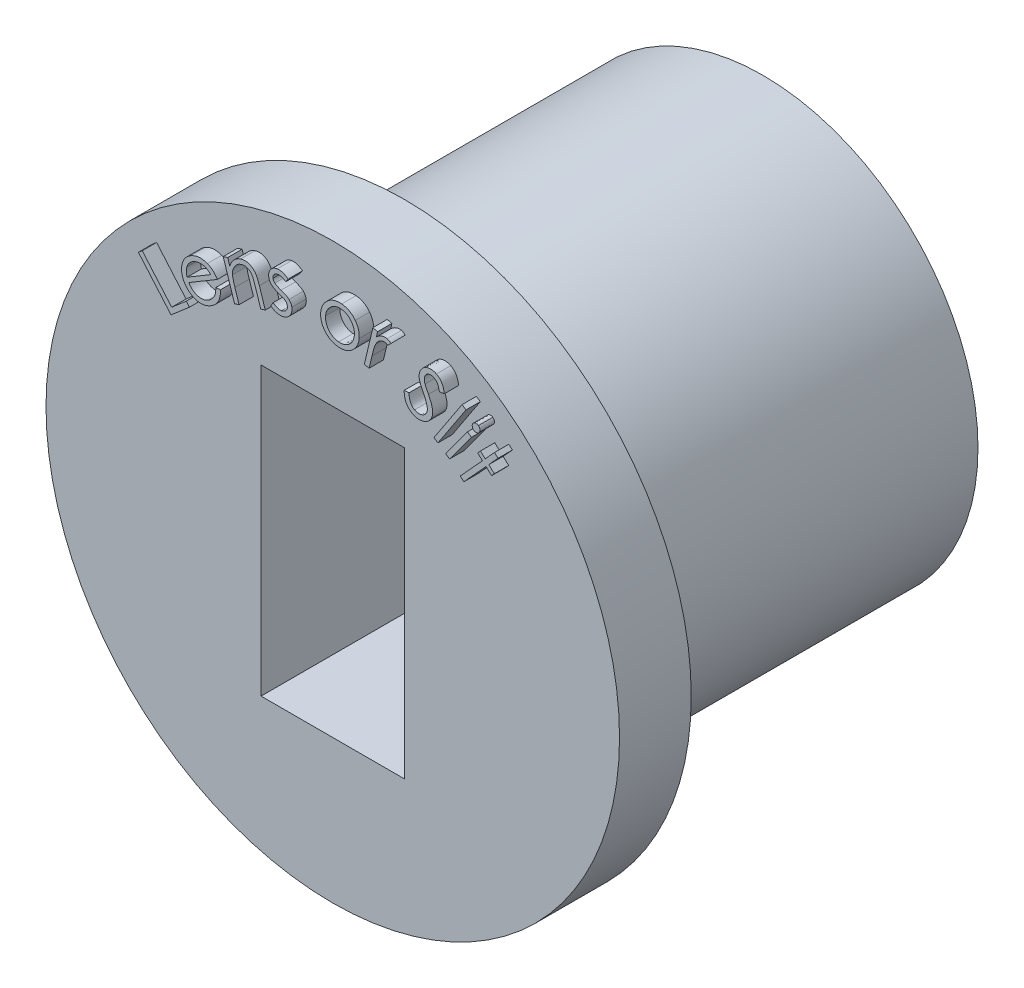
from build123d import *

# Parameters (mm, degrees)
SKETCH1_R           = 15
SKETCH1_W           = 10
SKETCH1_H           = 20
BOSS_EXTRUDE1_DEPTH = 25
SKETCH2_R           = 20
SKETCH2_W           = 10
SKETCH2_H           = 20
BOSS_EXTRUDE2_DEPTH = 5
BOSS_EXTRUDE3_DEPTH = 1


with BuildPart() as part:
    # Sketch1 → Boss-Extrude1 (new body)
    with BuildSketch(Plane.XY):
        Circle(SKETCH1_R)
        Rectangle(SKETCH1_W, SKETCH1_H, mode=Mode.SUBTRACT)
    extrude(amount=BOSS_EXTRUDE1_DEPTH)

    # Sketch2 → Boss-Extrude2 (add)
    with BuildSketch(Plane.XY.offset(25)):
        Circle(SKETCH2_R)
        Rectangle(SKETCH2_W, SKETCH2_H, mode=Mode.SUBTRACT)
    extrude(amount=BOSS_EXTRUDE2_DEPTH)

    # Sketch3 → Boss-Extrude3 (add)
    # profile 1 of 11: a face of its own
    with BuildSketch(Plane.XY.offset(30)):
        Polygon((12.280012906, 13.855492235), (12.527508899, 13.629731017), (11.880373483, 12.921598004), (12.269496079, 12.566129254), (12.077388707, 12.355792715), (11.688266111, 12.711261465), (10.139488066, 11.014546722), (9.891992073, 11.24030794), (11.440770117, 12.937022683), (11.106335021, 13.242711786), (11.298442393, 13.453048324), (11.632877489, 13.147359222), align=None)
    # profile 2 of 11: a face of its own
    with BuildSketch(Plane.XY.offset(30)):
        with BuildLine():
            add(Edge.make_bspline(
                [(11.158694311, 14.918955756), (11.173048853, 14.907377467), (11.201092682, 14.88475748), (11.233333186, 14.841105437), (11.255836986, 14.792111188), (11.268928006, 14.739056839), (11.272686342, 14.684853485), (11.265717383, 14.631542336), (11.24716263, 14.580941884), (11.227549596, 14.550767221), (11.217588541, 14.535442134)],
                knots=[0, 0, 0, 0, 1.023822878, 2.000196958, 2.99035988, 4.010202223, 5.027715397, 5.999827523, 6.984153789, 8, 8, 8, 8], degree=3))
            add(Edge.make_bspline(
                [(11.217588541, 14.535442134), (11.20625231, 14.521306848), (11.184113114, 14.493701213), (11.140951292, 14.462288631), (11.09269708, 14.43959769), (11.039803228, 14.426374808), (10.985339592, 14.423827271), (10.93179812, 14.430361515), (10.880976628, 14.449098018), (10.850802154, 14.468697233), (10.835477163, 14.478651269)],
                knots=[0, 0, 0, 0, 1.010024463, 1.972536316, 2.955356377, 3.979839316, 5.001229279, 5.990726125, 6.979531377, 8, 8, 8, 8], degree=3))
            add(Edge.make_bspline(
                [(10.835477163, 14.478651269), (10.821602513, 14.490023619), (10.794376563, 14.512339354), (10.763235652, 14.555134915), (10.740098072, 14.602998314), (10.727425267, 14.655766335), (10.7235033, 14.710206605), (10.730783089, 14.763231304), (10.747377217, 14.814177708), (10.767176494, 14.843625924), (10.777284054, 14.858659282)],
                knots=[0, 0, 0, 0, 1.006926823, 1.975872422, 2.953366135, 3.984697055, 5.013672567, 6.009783536, 6.983991547, 8, 8, 8, 8], degree=3))
            add(Edge.make_bspline(
                [(10.777284054, 14.858659282), (10.788949457, 14.872676931), (10.811936859, 14.90029958), (10.854557521, 14.9333573), (10.903813098, 14.955006082), (10.956468699, 14.968316043), (11.010856731, 14.971646889), (11.064012712, 14.966068794), (11.114034101, 14.947642042), (11.143592709, 14.928655865), (11.158694311, 14.918955756)],
                knots=[0, 0, 0, 0, 1.021064848, 2.012071682, 2.991656686, 4.018510453, 5.043019038, 6.033158621, 6.995133462, 8, 8, 8, 8], degree=3))
        make_face()
    # profile 3 of 11: a face of its own
    with BuildSketch(Plane.XY.offset(30)):
        Polygon((10.397977163, 14.16244534), (10.666506811, 13.965430115), (9.14296915, 11.891511846), (8.874439503, 12.08852707), align=None)
    # profile 4 of 11: a face of its own
    with BuildSketch(Plane.XY.offset(30)):
        Polygon((10.017616344, 15.61553359), (10.29315721, 15.433943045), (8.332820671, 12.460485513), (8.057279806, 12.642076058), align=None)
    # profile 5 of 11: a face of its own
    with BuildSketch(Plane.XY.offset(30)):
        with BuildLine():
            Line((5.974661386, 14.451609991), (6.316808822, 14.477551498))
            add(Edge.make_bspline(
                [(6.316808822, 14.477551498), (6.319328783, 14.425575727), (6.324140862, 14.326323586), (6.346545225, 14.185188581), (6.377061583, 14.058159144), (6.419580549, 13.945393962), (6.474118651, 13.847651546), (6.537911775, 13.763311791), (6.614137236, 13.694209408), (6.672530048, 13.660680916), (6.701724688, 13.643917683)],
                knots=[0, 0, 0, 0, 1.294332013, 2.471636748, 3.550932804, 4.54157675, 5.460838043, 6.327658205, 7.163879688, 8, 8, 8, 8], degree=3))
            add(Edge.make_bspline(
                [(6.701724688, 13.643917683), (6.727862714, 13.63178557), (6.779449964, 13.607841055), (6.861345851, 13.583920057), (6.945224594, 13.570772307), (7.030178737, 13.567147205), (7.11388385, 13.573868674), (7.193570857, 13.591470689), (7.268356582, 13.618909376), (7.336966289, 13.657071381), (7.399205056, 13.703307632), (7.454369687, 13.756074285), (7.501495255, 13.815523438), (7.525894259, 13.859489963), (7.538162989, 13.881597972)],
                knots=[0, 0, 0, 0, 1.071300609, 2.114369768, 3.162539894, 4.22458465, 5.271960517, 6.278599416, 7.252851185, 8.226092924, 9.189843586, 10.131036101, 11.060215223, 12, 12, 12, 12], degree=3))
            add(Edge.make_bspline(
                [(7.538162989, 13.881597972), (7.549894226, 13.908145054), (7.573645265, 13.961892224), (7.591502122, 14.05016733), (7.59786236, 14.143752097), (7.590389914, 14.207190264), (7.586540393, 14.239871209)],
                knots=[0, 0, 0, 0, 0.946354176, 1.915986831, 2.926395213, 4, 4, 4, 4], degree=3))
            add(Edge.make_bspline(
                [(7.586540393, 14.239871209), (7.582422461, 14.26424329), (7.573769977, 14.315453221), (7.553373094, 14.394883051), (7.527685929, 14.480822159), (7.494698331, 14.572871585), (7.457306089, 14.671581513), (7.412511566, 14.77631339), (7.362287052, 14.887713564), (7.325232791, 14.963528176), (7.306091675, 15.002691722)],
                knots=[0, 0, 0, 0, 0.727086387, 1.527733436, 2.411096097, 3.365963597, 4.404357759, 5.516922391, 6.717316843, 8, 8, 8, 8], degree=3))
            add(Edge.make_bspline(
                [(7.306091675, 15.002691722), (7.287075844, 15.041679637), (7.250735919, 15.116186922), (7.200142103, 15.223309921), (7.156429597, 15.320694735), (7.120070887, 15.408825738), (7.088849195, 15.486831599), (7.064862206, 15.555562073), (7.047443849, 15.614504079), (7.040147212, 15.650943407), (7.036860906, 15.667355183)],
                knots=[0, 0, 0, 0, 1.448216104, 2.76759223, 3.955150454, 5.011501203, 5.950409205, 6.75977509, 7.441419598, 8, 8, 8, 8], degree=3))
            add(Edge.make_bspline(
                [(7.036860906, 15.667355183), (7.032966854, 15.692081372), (7.025245059, 15.741112704), (7.020597006, 15.814520611), (7.021153733, 15.88647439), (7.027459135, 15.956829331), (7.039449575, 16.025759746), (7.056857993, 16.093438471), (7.080899003, 16.159396492), (7.100593857, 16.201974757), (7.110478694, 16.223344767)],
                knots=[0, 0, 0, 0, 1.052088584, 2.086261862, 3.088710417, 4.075427982, 5.052901627, 6.027802968, 7.010155264, 8, 8, 8, 8], degree=3))
            add(Edge.make_bspline(
                [(7.110478694, 16.223344767), (7.12842154, 16.255595575), (7.163809154, 16.319201936), (7.229477941, 16.405646306), (7.306052667, 16.480263596), (7.391002869, 16.544345354), (7.483831851, 16.596433543), (7.582848745, 16.635315225), (7.687798218, 16.659185431), (7.796405728, 16.669287113), (7.906891678, 16.66680507), (8.01619596, 16.649746782), (8.123601195, 16.618923178), (8.191496727, 16.587668527), (8.22596347, 16.571802299)],
                knots=[0, 0, 0, 0, 1.018769018, 2.009257862, 2.986334619, 3.963880602, 4.940957359, 5.918162109, 6.89235458, 7.904246117, 8.924732369, 9.937447553, 10.952958141, 12, 12, 12, 12], degree=3))
            add(Edge.make_bspline(
                [(8.22596347, 16.571802299), (8.26134735, 16.552367752), (8.331391598, 16.513896047), (8.426358913, 16.440506356), (8.51003461, 16.354974572), (8.571346363, 16.27441543), (8.615202271, 16.202847267), (8.64567233, 16.142416502), (8.674791737, 16.076373738), (8.70014381, 16.003654276), (8.725049164, 15.925534061), (8.74620045, 15.840812764), (8.767031428, 15.75075453), (8.777820708, 15.688217119), (8.783355297, 15.656137235)],
                knots=[0, 0, 0, 0, 1.298236935, 2.569928111, 3.846883915, 5.141080741, 5.819851908, 6.546713814, 7.31834626, 8.141833165, 9.024741758, 9.9572964, 10.95215212, 12, 12, 12, 12], degree=3))
            Line((8.783355297, 15.656137235), (8.434897765, 15.59163403))
            add(Edge.make_bspline(
                [(8.434897765, 15.59163403), (8.430179032, 15.617380062), (8.421054457, 15.667164957), (8.4048204, 15.738412184), (8.388050598, 15.80389987), (8.370516483, 15.863528928), (8.352608909, 15.91778518), (8.332844847, 15.966108956), (8.312894871, 16.008947331), (8.284745733, 16.057698244), (8.245002449, 16.1111413), (8.190831909, 16.168051662), (8.12830948, 16.216215549), (8.082348912, 16.241900623), (8.059096483, 16.254895248)],
                knots=[0, 0, 0, 0, 1.185424393, 2.292245544, 3.308941189, 4.246811103, 5.10709974, 5.895339888, 6.610305932, 7.245783415, 8.441981835, 9.617343988, 10.794563669, 12, 12, 12, 12], degree=3))
            add(Edge.make_bspline(
                [(8.059096483, 16.254895248), (8.028685665, 16.268762928), (7.969754304, 16.295636302), (7.876299706, 16.314393336), (7.784348962, 16.315516955), (7.695752385, 16.297766279), (7.613496282, 16.264328417), (7.540903203, 16.215947919), (7.480606802, 16.152109526), (7.451406646, 16.101330255), (7.436500329, 16.075408068)],
                knots=[0, 0, 0, 0, 1.105526546, 2.142335817, 3.134576258, 4.137927418, 5.118226667, 6.062050744, 7.010700974, 8, 8, 8, 8], degree=3))
            add(Edge.make_bspline(
                [(7.436500329, 16.075408068), (7.428629193, 16.058505124), (7.412887541, 16.024700565), (7.396277182, 15.970953749), (7.384979455, 15.915286781), (7.379343725, 15.857040853), (7.379738752, 15.794630981), (7.390026363, 15.726948744), (7.405797699, 15.652521393), (7.421792003, 15.601563755), (7.430190233, 15.574807107)],
                knots=[0, 0, 0, 0, 0.867937434, 1.735806555, 2.613525405, 3.510685419, 4.458114981, 5.513026733, 6.694149273, 8, 8, 8, 8], degree=3))
            add(Edge.make_bspline(
                [(7.430190233, 15.574807107), (7.433592002, 15.5656494), (7.4418046, 15.543540742), (7.459352581, 15.506173258), (7.480388893, 15.457498891), (7.509434152, 15.39952163), (7.541483845, 15.329921357), (7.58133383, 15.251204025), (7.625419201, 15.16142161), (7.6572817, 15.09847602), (7.674180617, 15.065091562)],
                knots=[0, 0, 0, 0, 0.41462089, 1.000983375, 1.751573742, 2.665807653, 3.753235783, 5.00463505, 6.411347984, 8, 8, 8, 8], degree=3))
            add(Edge.make_bspline(
                [(7.674180617, 15.065091562), (7.694241815, 15.024756046), (7.733209795, 14.94640611), (7.786673862, 14.830839189), (7.832710217, 14.721064899), (7.872693426, 14.617472156), (7.904650006, 14.519804444), (7.930499178, 14.428213258), (7.948671712, 14.342455992), (7.961192974, 14.261944706), (7.966326694, 14.185500857), (7.968138253, 14.11224108), (7.964677863, 14.041225967), (7.956045963, 13.972419713), (7.94379906, 13.905741936), (7.926002637, 13.841560908), (7.903801171, 13.779512547), (7.884864807, 13.740055894), (7.875402572, 13.720339959)],
                knots=[0, 0, 0, 0, 1.530796782, 2.973504325, 4.326047655, 5.575323898, 6.745644011, 7.816923318, 8.807571732, 9.722939322, 10.582995324, 11.40908726, 12.2121836, 12.996285511, 13.764172541, 14.513645723, 15.257289628, 16, 16, 16, 16], degree=3))
            add(Edge.make_bspline(
                [(7.875402572, 13.720339959), (7.860725647, 13.693159046), (7.831685508, 13.6393782), (7.779488562, 13.564672994), (7.720287505, 13.497188066), (7.654729861, 13.436217682), (7.581875565, 13.383074811), (7.503061441, 13.335541386), (7.416986931, 13.295968992), (7.326136695, 13.262502096), (7.232089564, 13.237167157), (7.137161447, 13.221930787), (7.042777669, 13.215172636), (6.94884059, 13.219067503), (6.855268227, 13.231393126), (6.762455004, 13.25439701), (6.669713345, 13.285707952), (6.610087526, 13.314005431), (6.579729495, 13.328412876)],
                knots=[0, 0, 0, 0, 0.985620266, 1.950173325, 2.901944126, 3.847052846, 4.802122689, 5.775895137, 6.780619052, 7.821591209, 8.864059706, 9.884616544, 10.886677318, 11.879725291, 12.881119173, 13.894532367, 14.928017252, 16, 16, 16, 16], degree=3))
            add(Edge.make_bspline(
                [(6.579729495, 13.328412876), (6.556614917, 13.340430919), (6.510825685, 13.364238274), (6.44649114, 13.406053607), (6.38570888, 13.450833044), (6.329448855, 13.50033587), (6.276931246, 13.553488268), (6.228403639, 13.610423698), (6.184020807, 13.671206081), (6.143109936, 13.735873602), (6.106283508, 13.805537386), (6.075209926, 13.881193246), (6.04660897, 13.961913581), (6.024124446, 14.048841568), (6.004971511, 14.141243342), (5.990490245, 14.239572888), (5.979921141, 14.343686198), (5.976439314, 14.415129067), (5.974661386, 14.451609991)],
                knots=[0, 0, 0, 0, 0.927450837, 1.837250134, 2.729631161, 3.614526162, 4.503366985, 5.389122969, 6.276559372, 7.181892011, 8.112773443, 9.07904855, 10.092609502, 11.160762312, 12.274178907, 13.452631764, 14.699235513, 16, 16, 16, 16], degree=3))
        make_face()
    # profile 6 of 11: a face of its own
    with BuildSketch(Plane.XY.offset(30)):
        with BuildLine():
            Line((3.796158492, 17.150463757), (4.124984614, 17.072639238))
            Line((4.124984614, 17.072639238), (4.038746633, 16.706653661))
            add(Edge.make_bspline(
                [(4.038746633, 16.706653661), (4.07119671, 16.735317134), (4.13355563, 16.790399381), (4.231675301, 16.860064937), (4.32793829, 16.916213415), (4.423293125, 16.958362278), (4.517602846, 16.986189391), (4.610798585, 16.999574263), (4.702702698, 17.000686356), (4.762178542, 16.989272186), (4.791751441, 16.98359677)],
                knots=[0, 0, 0, 0, 1.242861831, 2.388392467, 3.449973023, 4.438949607, 5.375771739, 6.264334171, 7.136982903, 8, 8, 8, 8], degree=3))
            add(Edge.make_bspline(
                [(4.791751441, 16.98359677), (4.814177421, 16.976958852), (4.86029082, 16.96330964), (4.927397133, 16.930203996), (4.993751576, 16.885444602), (5.035203612, 16.849011226), (5.056775479, 16.830051097)],
                knots=[0, 0, 0, 0, 0.905514432, 1.861963136, 2.887353866, 4, 4, 4, 4], degree=3))
            Line((5.056775479, 16.830051097), (4.824003043, 16.598680905))
            add(Edge.make_bspline(
                [(4.824003043, 16.598680905), (4.80939718, 16.609128523), (4.781915455, 16.628786285), (4.740997012, 16.654293852), (4.701812596, 16.671701814), (4.676139612, 16.679754895), (4.664147274, 16.683516642)],
                knots=[0, 0, 0, 0, 1.183709244, 2.227213241, 3.171897665, 4, 4, 4, 4], degree=3))
            add(Edge.make_bspline(
                [(4.664147274, 16.683516642), (4.637118997, 16.688189324), (4.582283428, 16.697669365), (4.496179781, 16.690066014), (4.408602866, 16.665229537), (4.335499532, 16.632109151), (4.276700423, 16.59780844), (4.233589097, 16.56514559), (4.190945476, 16.528394568), (4.149566833, 16.486276785), (4.11002217, 16.438525385), (4.07109201, 16.386157846), (4.033276079, 16.328875734), (4.010001729, 16.287990185), (3.998081569, 16.267050296)],
                knots=[0, 0, 0, 0, 1.167269928, 2.368183222, 3.651326266, 5.04053291, 5.783324979, 6.553759094, 7.346115326, 8.185884005, 9.071371641, 9.991497813, 10.971328174, 12, 12, 12, 12], degree=3))
            add(Edge.make_bspline(
                [(3.998081569, 16.267050296), (3.988506562, 16.248226492), (3.967199108, 16.206337506), (3.937770446, 16.135025369), (3.906931134, 16.049563379), (3.875139295, 15.950273379), (3.841323571, 15.836945644), (3.806573589, 15.709465335), (3.770090895, 15.567828875), (3.746231294, 15.468509112), (3.733758652, 15.416589559)],
                knots=[0, 0, 0, 0, 0.567784279, 1.26350172, 2.072718059, 3.010861545, 4.066775792, 5.253044338, 6.564024845, 8, 8, 8, 8], degree=3))
            Line((3.733758652, 15.416589559), (3.533237819, 14.569634431))
            Line((3.533237819, 14.569634431), (3.204411697, 14.64745895))
            Line((3.204411697, 14.64745895), (3.796158492, 17.150463757))
        make_face()
    # profile 7 of 11: a face of its own
    with BuildSketch(Plane.XY.offset(30)):
        with BuildLine():
            add(Edge.make_bspline(
                [(1.62327509, 17.498161232), (1.671587593, 17.492641745), (1.766739768, 17.481771034), (1.90455536, 17.44806592), (2.035035417, 17.402578129), (2.1579878, 17.344172529), (2.272844432, 17.272151655), (2.379840579, 17.187129113), (2.480595424, 17.090367056), (2.539276551, 17.016737309), (2.569088391, 16.979331104)],
                knots=[0, 0, 0, 0, 1.048152472, 2.064351485, 3.052973447, 4.024935143, 4.994382938, 5.970767439, 6.969086645, 8, 8, 8, 8], degree=3))
            add(Edge.make_bspline(
                [(2.569088391, 16.979331104), (2.594596111, 16.943815773), (2.644964783, 16.87368563), (2.706948356, 16.761372517), (2.758875829, 16.646419569), (2.79900056, 16.527636862), (2.827011064, 16.404970786), (2.843659348, 16.278960604), (2.84994658, 16.149374622), (2.844090973, 16.062245672), (2.841123648, 16.018093124)],
                knots=[0, 0, 0, 0, 1.02535607, 2.024713425, 3.004249461, 3.982433394, 4.961631579, 5.95214576, 6.962250973, 8, 8, 8, 8], degree=3))
            add(Edge.make_bspline(
                [(2.841123648, 16.018093124), (2.836210818, 15.973769294), (2.826509811, 15.886246254), (2.795975256, 15.759033482), (2.7563972, 15.636649241), (2.703950762, 15.519896536), (2.640734218, 15.408074344), (2.566091326, 15.301462009), (2.479001411, 15.20140402), (2.383459332, 15.106464293), (2.278742207, 15.021053095), (2.16708874, 14.948074799), (2.050113669, 14.887542687), (1.926688938, 14.842277538), (1.798434258, 14.808024382), (1.664114391, 14.788843953), (1.524601859, 14.782242192), (1.430215194, 14.788128608), (1.382089193, 14.791129982)],
                knots=[0, 0, 0, 0, 1.006332256, 1.987131055, 2.94860647, 3.907964062, 4.872376391, 5.846218881, 6.841862345, 7.86459051, 8.885191455, 9.888070685, 10.872499039, 11.85295688, 12.85160418, 13.865357031, 14.911585325, 16, 16, 16, 16], degree=3))
            add(Edge.make_bspline(
                [(1.382089193, 14.791129982), (1.334013757, 14.796428323), (1.239634516, 14.806829755), (1.103226933, 14.839430791), (0.973900739, 14.881650429), (0.852870409, 14.937360697), (0.739851747, 15.00515567), (0.634803623, 15.084890457), (0.537611368, 15.176641624), (0.449366646, 15.279071094), (0.371478211, 15.389259607), (0.304589874, 15.503750886), (0.249441752, 15.621479902), (0.206389973, 15.742323376), (0.176134696, 15.866658058), (0.158093662, 15.994128994), (0.151054196, 16.124947602), (0.157019563, 16.212788856), (0.160033904, 16.257175656)],
                knots=[0, 0, 0, 0, 1.090003247, 2.139838725, 3.156717659, 4.154492421, 5.138115821, 6.123912229, 7.123342773, 8.147410914, 9.168353615, 10.162906344, 11.134548535, 12.09659076, 13.051675229, 14.015622033, 14.997279952, 16, 16, 16, 16], degree=3))
            add(Edge.make_bspline(
                [(0.160033904, 16.257175656), (0.165078917, 16.301004176), (0.175028582, 16.387441845), (0.203582592, 16.513441571), (0.242281591, 16.634037893), (0.291266397, 16.74957856), (0.352004797, 16.859286723), (0.423199776, 16.963422963), (0.504790937, 17.062368138), (0.566348488, 17.122663384), (0.597533904, 17.153209309)],
                knots=[0, 0, 0, 0, 1.036736063, 2.044628661, 3.031708707, 4.01157327, 4.990451185, 5.975065498, 6.974156293, 8, 8, 8, 8], degree=3))
            add(Edge.make_bspline(
                [(0.597533904, 17.153209309), (0.633609674, 17.184824257), (0.704614135, 17.247048912), (0.820456813, 17.326080107), (0.941897377, 17.389910108), (1.067778267, 17.441207333), (1.199494803, 17.476700853), (1.33612359, 17.499449411), (1.478412926, 17.507312946), (1.57445134, 17.501245688), (1.62327509, 17.498161232)],
                knots=[0, 0, 0, 0, 1.030597183, 2.028425131, 3.006126428, 3.975529885, 4.944568689, 5.932480404, 6.948919953, 8, 8, 8, 8], degree=3))
        make_face()
        with BuildLine():
            add(Edge.make_bspline(
                [(1.594529097, 17.173541841), (1.560652375, 17.175645588), (1.493808693, 17.179796583), (1.394387183, 17.173795258), (1.297849599, 17.158392527), (1.203854173, 17.133289305), (1.1131772, 17.096645583), (1.024240721, 17.052264628), (0.939476732, 16.995927193), (0.857771899, 16.932043418), (0.782354482, 16.860552389), (0.71405361, 16.783856618), (0.656117869, 16.701321349), (0.605715315, 16.614813544), (0.564864014, 16.523116166), (0.53356588, 16.426443906), (0.509742809, 16.325164713), (0.501937109, 16.255421017), (0.497974609, 16.2200162)],
                knots=[0, 0, 0, 0, 1.007996201, 1.988922597, 2.952681951, 3.909710078, 4.873194077, 5.8547842, 6.858487719, 7.892285688, 8.933917245, 9.942774572, 10.939145352, 11.925589158, 12.914328897, 13.915915301, 14.942031461, 16, 16, 16, 16], degree=3))
            add(Edge.make_bspline(
                [(0.497974609, 16.2200162), (0.495312045, 16.173969334), (0.490043027, 16.082846002), (0.504302413, 15.946727694), (0.535334253, 15.814172373), (0.582923299, 15.686244283), (0.645513655, 15.56614224), (0.722200181, 15.456971167), (0.813312627, 15.361655439), (0.915487514, 15.278622362), (1.028324352, 15.210973281), (1.14886753, 15.158355656), (1.276787965, 15.121987358), (1.365287545, 15.110867469), (1.410134065, 15.105232547)],
                knots=[0, 0, 0, 0, 1.033020556, 2.044271066, 3.056268363, 4.079509444, 5.096975427, 6.085865688, 7.060935983, 8.04485499, 9.03002962, 10.001812113, 10.987432801, 12, 12, 12, 12], degree=3))
            add(Edge.make_bspline(
                [(1.410134065, 15.105232547), (1.455242874, 15.102920202), (1.544012866, 15.098369719), (1.67619256, 15.111386756), (1.803890218, 15.141871656), (1.926673184, 15.188678567), (2.041899916, 15.25208028), (2.147953369, 15.330187916), (2.242674378, 15.424012762), (2.32542819, 15.5310113), (2.395606594, 15.647990376), (2.448831093, 15.773146223), (2.48737647, 15.904227412), (2.498801536, 15.994719626), (2.504585186, 16.040529021)],
                knots=[0, 0, 0, 0, 1.013094224, 1.993676313, 2.969896172, 3.953198328, 4.934846908, 5.91403801, 6.901057555, 7.918166413, 8.94408974, 9.954884675, 10.964712073, 12, 12, 12, 12], degree=3))
            add(Edge.make_bspline(
                [(2.504585186, 16.040529021), (2.506916272, 16.076037114), (2.511517231, 16.146120882), (2.50629869, 16.250199614), (2.49151076, 16.350865568), (2.467694702, 16.44843487), (2.433751643, 16.542835103), (2.390208488, 16.634289961), (2.336500829, 16.722101572), (2.274339817, 16.805693758), (2.205713253, 16.883413674), (2.132116801, 16.953633753), (2.052790586, 17.013164924), (1.970155733, 17.064997513), (1.88245852, 17.106341649), (1.790759154, 17.139064583), (1.694210993, 17.161427602), (1.628042984, 17.169468933), (1.594529097, 17.173541841)],
                knots=[0, 0, 0, 0, 1.057364465, 2.086963232, 3.091325283, 4.078960937, 5.068062289, 6.068908449, 7.085480367, 8.123672895, 9.162423415, 10.165245771, 11.142288205, 12.106495205, 13.060734674, 14.018988715, 14.996624044, 16, 16, 16, 16], degree=3))
        make_face(mode=Mode.SUBTRACT)
    # profile 8 of 11: a face of its own
    with BuildSketch(Plane.XY.offset(30)):
        with BuildLine():
            Line((-2.106228975, 17.135822778), (-2.28361279, 16.885522297))
            add(Edge.make_bspline(
                [(-2.28361279, 16.885522297), (-2.308369298, 16.902512624), (-2.356177431, 16.935323221), (-2.429877257, 16.976635713), (-2.501141158, 17.01158371), (-2.571355294, 17.037759949), (-2.64006962, 17.055253187), (-2.70689207, 17.066350059), (-2.772694202, 17.068725684), (-2.815561523, 17.063896321), (-2.836797886, 17.061503867)],
                knots=[0, 0, 0, 0, 1.21071288, 2.338048667, 3.404941079, 4.410232481, 5.354658369, 6.261437886, 7.138720708, 8, 8, 8, 8], degree=3))
            add(Edge.make_bspline(
                [(-2.836797886, 17.061503867), (-2.862333927, 17.056429586), (-2.912354864, 17.046489897), (-2.981685594, 17.014551684), (-3.042945312, 16.970314599), (-3.094620889, 16.915214662), (-3.136277435, 16.853967456), (-3.162660611, 16.787720534), (-3.176018038, 16.719049541), (-3.171438432, 16.673107254), (-3.169129616, 16.649945374)],
                knots=[0, 0, 0, 0, 1.064152654, 2.084501325, 3.100117264, 4.143631852, 5.16654055, 6.116465669, 7.050413061, 8, 8, 8, 8], degree=3))
            add(Edge.make_bspline(
                [(-3.169129616, 16.649945374), (-3.164820245, 16.629571583), (-3.156102826, 16.588357488), (-3.127252962, 16.530701598), (-3.089094264, 16.475250714), (-3.055951157, 16.44349669), (-3.038720963, 16.426988643)],
                knots=[0, 0, 0, 0, 0.945732277, 1.91311969, 2.915088081, 4, 4, 4, 4], degree=3))
            add(Edge.make_bspline(
                [(-3.038720963, 16.426988643), (-3.028607526, 16.418350901), (-3.006948734, 16.399852438), (-2.968386667, 16.375081544), (-2.923777115, 16.349210817), (-2.872433626, 16.323396297), (-2.814535232, 16.297504815), (-2.750282934, 16.270968464), (-2.679237272, 16.244201909), (-2.629323914, 16.227470675), (-2.603324328, 16.21875547)],
                knots=[0, 0, 0, 0, 0.656992229, 1.407005137, 2.261323301, 3.20711855, 4.246749804, 5.39706685, 6.644146818, 8, 8, 8, 8], degree=3))
            add(Edge.make_bspline(
                [(-2.603324328, 16.21875547), (-2.571460236, 16.207759927), (-2.509932836, 16.186528281), (-2.422195749, 16.152206264), (-2.341871185, 16.116847747), (-2.268508316, 16.081786537), (-2.202872491, 16.044987559), (-2.144584433, 16.008105572), (-2.093499434, 15.970332318), (-2.063716315, 15.942997679), (-2.04943811, 15.92989329)],
                knots=[0, 0, 0, 0, 1.285394805, 2.482010117, 3.591477852, 4.631850833, 5.581493441, 6.459193166, 7.26132801, 8, 8, 8, 8], degree=3))
            add(Edge.make_bspline(
                [(-2.04943811, 15.92989329), (-2.024816585, 15.903093041), (-1.976080888, 15.850044791), (-1.920949585, 15.756836925), (-1.878658826, 15.656717374), (-1.864959953, 15.58530193), (-1.85803186, 15.549184156)],
                knots=[0, 0, 0, 0, 1.005672621, 1.990622263, 2.983773691, 4, 4, 4, 4], degree=3))
            add(Edge.make_bspline(
                [(-1.85803186, 15.549184156), (-1.85474655, 15.523283684), (-1.848312116, 15.47255639), (-1.84697239, 15.396448159), (-1.853034258, 15.322384354), (-1.867500488, 15.250133556), (-1.888298442, 15.180037286), (-1.916955192, 15.111774097), (-1.952489393, 15.045463212), (-1.995452439, 14.981780437), (-2.043640372, 14.922010436), (-2.09767464, 14.868514926), (-2.154989163, 14.820164639), (-2.218256153, 14.77952208), (-2.285382771, 14.744579146), (-2.356788172, 14.715311232), (-2.433106598, 14.693715869), (-2.485911768, 14.684035711), (-2.512879616, 14.679092008)],
                knots=[0, 0, 0, 0, 1.030915368, 2.019096375, 3.001392725, 3.961167121, 4.925196171, 5.885503429, 6.881119806, 7.89270784, 8.916610802, 9.909053549, 10.892694353, 11.873600946, 12.873063561, 13.879581793, 14.917092448, 16, 16, 16, 16], degree=3))
            add(Edge.make_bspline(
                [(-2.512879616, 14.679092008), (-2.549516769, 14.674749948), (-2.622163394, 14.666140218), (-2.732318416, 14.668028567), (-2.841717112, 14.681903428), (-2.949281161, 14.708767311), (-3.052926007, 14.746186458), (-3.149985584, 14.795128887), (-3.240983606, 14.85284391), (-3.294506068, 14.900133595), (-3.321273046, 14.923783515)],
                knots=[0, 0, 0, 0, 1.012915596, 2.008477552, 3.018579431, 4.037301611, 5.049117119, 6.040027861, 7.019803479, 8, 8, 8, 8], degree=3))
            Line((-3.321273046, 14.923783515), (-3.151601572, 15.190910919))
            add(Edge.make_bspline(
                [(-3.151601572, 15.190910919), (-3.127371948, 15.171557472), (-3.080439139, 15.134069824), (-3.006836911, 15.086297193), (-2.934295596, 15.046403266), (-2.861390425, 15.017110226), (-2.789524883, 14.995051244), (-2.717538442, 14.984403953), (-2.645930517, 14.980679523), (-2.598854689, 14.986215476), (-2.575279456, 14.988987842)],
                knots=[0, 0, 0, 0, 1.18104614, 2.287687705, 3.339653367, 4.330304719, 5.277194446, 6.196716039, 7.096928514, 8, 8, 8, 8], degree=3))
            add(Edge.make_bspline(
                [(-2.575279456, 14.988987842), (-2.543565824, 14.995165743), (-2.481770401, 15.007203658), (-2.396913697, 15.046989429), (-2.321020593, 15.098993147), (-2.258190194, 15.165979408), (-2.207629856, 15.23993546), (-2.17519488, 15.319988588), (-2.159779012, 15.403155914), (-2.165192966, 15.458718319), (-2.167927693, 15.486784316)],
                knots=[0, 0, 0, 0, 1.084029087, 2.112278856, 3.12948048, 4.164601627, 5.18593379, 6.128383629, 7.054598541, 8, 8, 8, 8], degree=3))
            add(Edge.make_bspline(
                [(-2.167927693, 15.486784316), (-2.172389341, 15.509736058), (-2.181158916, 15.554848774), (-2.210135244, 15.617479959), (-2.247602104, 15.675632646), (-2.281250864, 15.707554734), (-2.298336347, 15.723763483)],
                knots=[0, 0, 0, 0, 1.012813072, 1.990731237, 2.979774392, 4, 4, 4, 4], degree=3))
            add(Edge.make_bspline(
                [(-2.298336347, 15.723763483), (-2.30846041, 15.731932894), (-2.330202675, 15.749477382), (-2.369043381, 15.772924769), (-2.414486193, 15.798247812), (-2.467803937, 15.824115734), (-2.528881583, 15.849684327), (-2.597253785, 15.876265441), (-2.67252936, 15.904496081), (-2.725722321, 15.922131285), (-2.753364392, 15.931295534)],
                knots=[0, 0, 0, 0, 0.620657935, 1.332914488, 2.162271351, 3.105753496, 4.160997139, 5.323803692, 6.609297017, 8, 8, 8, 8], degree=3))
            add(Edge.make_bspline(
                [(-2.753364392, 15.931295534), (-2.783390474, 15.941510642), (-2.841319806, 15.961218653), (-2.923595838, 15.994715061), (-2.99930674, 16.028014178), (-3.0681368, 16.062337179), (-3.130340898, 16.097406742), (-3.185505854, 16.133539931), (-3.234091814, 16.170794131), (-3.262141943, 16.197927881), (-3.275700129, 16.21104313)],
                knots=[0, 0, 0, 0, 1.273710461, 2.457370166, 3.566858475, 4.595435215, 5.54558134, 6.433443996, 7.242796441, 8, 8, 8, 8], degree=3))
            add(Edge.make_bspline(
                [(-3.275700129, 16.21104313), (-3.299573445, 16.237415438), (-3.346930219, 16.289729388), (-3.400809465, 16.381297877), (-3.441491084, 16.480690407), (-3.455204432, 16.551454412), (-3.462198527, 16.587545534)],
                knots=[0, 0, 0, 0, 0.997460258, 1.978631774, 2.969059934, 4, 4, 4, 4], degree=3))
            add(Edge.make_bspline(
                [(-3.462198527, 16.587545534), (-3.46518997, 16.611345217), (-3.471068725, 16.658116113), (-3.472553899, 16.727893245), (-3.466755032, 16.795486882), (-3.455110529, 16.86116338), (-3.435794529, 16.924467635), (-3.410631115, 16.985985985), (-3.37796477, 17.044942321), (-3.339565947, 17.10156907), (-3.29577802, 17.154522246), (-3.247157603, 17.202442894), (-3.194238375, 17.245024372), (-3.136750898, 17.281047069), (-3.075590093, 17.312412758), (-3.010473533, 17.338478581), (-2.940537722, 17.357975535), (-2.892265633, 17.366865757), (-2.867647245, 17.371399701)],
                knots=[0, 0, 0, 0, 1.045734991, 2.055067792, 3.037006943, 4.000682322, 4.958463606, 5.918195567, 6.894404126, 7.892401274, 8.898641117, 9.886119794, 10.865144779, 11.854883075, 12.839569506, 13.859806581, 14.908518054, 16, 16, 16, 16], degree=3))
            add(Edge.make_bspline(
                [(-2.867647245, 17.371399701), (-2.838010182, 17.375008907), (-2.778388418, 17.382269655), (-2.68697591, 17.378456079), (-2.594174764, 17.365136252), (-2.499436097, 17.340986431), (-2.403207227, 17.305348227), (-2.305026432, 17.25954585), (-2.204790243, 17.203253394), (-2.139784771, 17.158779949), (-2.106228975, 17.135822778)],
                knots=[0, 0, 0, 0, 0.875753838, 1.761780172, 2.677315637, 3.626392324, 4.627594472, 5.68724996, 6.806159491, 8, 8, 8, 8], degree=3))
        make_face()
    # profile 9 of 11: a face of its own
    with BuildSketch(Plane.XY.offset(30)):
        with BuildLine():
            Line((-6.643195325, 16.226612945), (-6.326989396, 16.328976727))
            Line((-6.326989396, 16.328976727), (-6.184661671, 15.88867224))
            add(Edge.make_bspline(
                [(-6.184661671, 15.88867224), (-6.16609778, 15.93914215), (-6.130018568, 16.037231211), (-6.059562417, 16.173117454), (-5.98071527, 16.295655406), (-5.889883505, 16.403147427), (-5.789545482, 16.497239626), (-5.678017941, 16.575926949), (-5.557666941, 16.642848026), (-5.470740912, 16.673726313), (-5.426749011, 16.689353329)],
                knots=[0, 0, 0, 0, 1.125281946, 2.187003055, 3.198429732, 4.171094549, 5.12698824, 6.070964871, 7.023745548, 8, 8, 8, 8], degree=3))
            add(Edge.make_bspline(
                [(-5.426749011, 16.689353329), (-5.38145885, 16.702126459), (-5.292661903, 16.727169755), (-5.156661518, 16.741653413), (-5.022832146, 16.736329722), (-4.892886988, 16.709820088), (-4.768489955, 16.666766776), (-4.652888481, 16.605763624), (-4.547441906, 16.527835121), (-4.468581543, 16.448818009), (-4.40987774, 16.375111056), (-4.365902645, 16.310032628), (-4.323444223, 16.235079691), (-4.280783801, 16.151507636), (-4.23783152, 16.05914054), (-4.196871137, 15.956797611), (-4.155334993, 15.845644172), (-4.129637442, 15.767706356), (-4.116352377, 15.727414227)],
                knots=[0, 0, 0, 0, 1.218080799, 2.38819765, 3.528175492, 4.677084789, 5.813273364, 6.929780546, 8.051796681, 9.199859118, 9.812010145, 10.49253027, 11.233444539, 12.043572752, 12.924519296, 13.87289829, 14.900335411, 16, 16, 16, 16], degree=3))
            Line((-4.116352377, 15.727414227), (-3.708299492, 14.463291631))
            Line((-3.708299492, 14.463291631), (-4.022402056, 14.36162897))
            Line((-4.022402056, 14.36162897), (-4.401007825, 15.53320349))
            add(Edge.make_bspline(
                [(-4.401007825, 15.53320349), (-4.41212702, 15.567124457), (-4.433329859, 15.631807269), (-4.465263515, 15.723993583), (-4.494140884, 15.807258083), (-4.522435187, 15.881276649), (-4.54880115, 15.946054455), (-4.57324987, 16.001859809), (-4.596136207, 16.048230156), (-4.611919989, 16.075472893), (-4.619056703, 16.087790829)],
                knots=[0, 0, 0, 0, 1.435225844, 2.736786478, 3.922587731, 4.978402853, 5.9224253, 6.734350792, 7.427730499, 8, 8, 8, 8], degree=3))
            add(Edge.make_bspline(
                [(-4.619056703, 16.087790829), (-4.630501655, 16.105949511), (-4.652817043, 16.141355342), (-4.689686459, 16.190712447), (-4.727782318, 16.235786755), (-4.769039846, 16.275237069), (-4.81159889, 16.310311102), (-4.856039311, 16.340835478), (-4.902377786, 16.366092241), (-4.9505941, 16.386456336), (-5.000158275, 16.402974287), (-5.052022862, 16.413104598), (-5.105208977, 16.419621862), (-5.160149193, 16.42097879), (-5.216591859, 16.417073005), (-5.275072928, 16.40970371), (-5.335155408, 16.396026408), (-5.375396944, 16.384120969), (-5.395899652, 16.378055252)],
                knots=[0, 0, 0, 0, 1.133954046, 2.210985736, 3.253250177, 4.249031798, 5.223208028, 6.165302133, 7.093858997, 8.006925712, 8.92872215, 9.849193691, 10.794440109, 11.758146523, 12.748166582, 13.782275866, 14.870089064, 16, 16, 16, 16], degree=3))
            add(Edge.make_bspline(
                [(-5.395899652, 16.378055252), (-5.419423939, 16.369801862), (-5.46584654, 16.353514702), (-5.532154937, 16.322480255), (-5.594364515, 16.285516063), (-5.653077733, 16.243629608), (-5.708262446, 16.196492832), (-5.75865227, 16.143430124), (-5.805972284, 16.085693031), (-5.849071362, 16.023038339), (-5.887018079, 15.956932657), (-5.920607766, 15.889547357), (-5.946875608, 15.820271372), (-5.969175685, 15.750248809), (-5.984365228, 15.678343229), (-5.994188098, 15.60523148), (-5.998639973, 15.530903192), (-5.996922211, 15.481087256), (-5.996059909, 15.456080092)],
                knots=[0, 0, 0, 0, 1.011408239, 1.995903266, 2.965479442, 3.944659275, 4.920018217, 5.906202581, 6.910647821, 7.947317154, 8.988576416, 10.00247253, 10.999500144, 11.992594338, 12.982376016, 13.977777893, 14.984862236, 16, 16, 16, 16], degree=3))
            add(Edge.make_bspline(
                [(-5.996059909, 15.456080092), (-5.994444029, 15.438051121), (-5.990944243, 15.399002717), (-5.979439818, 15.336240545), (-5.965211079, 15.264310135), (-5.944757427, 15.18371925), (-5.92210933, 15.093717596), (-5.893691097, 14.995236614), (-5.861458959, 14.887410719), (-5.837511785, 14.812874718), (-5.824986191, 14.773888586)],
                knots=[0, 0, 0, 0, 0.616313307, 1.334854398, 2.171729304, 3.114015814, 4.166372937, 5.33320043, 6.605127709, 8, 8, 8, 8], degree=3))
            Line((-5.824986191, 14.773888586), (-5.534020646, 13.873648201))
            Line((-5.534020646, 13.873648201), (-5.850226575, 13.771284419))
            Line((-5.850226575, 13.771284419), (-6.643195325, 16.226612945))
        make_face()
    # profile 10 of 11: a face of its own
    with BuildSketch(Plane.XY.offset(30)):
        with BuildLine():
            Line((-7.156239125, 14.103855508), (-6.841435439, 14.11998131))
            add(Edge.make_bspline(
                [(-6.841435439, 14.11998131), (-6.83933369, 14.071151412), (-6.835239576, 13.976032916), (-6.840884242, 13.837004059), (-6.860335339, 13.706405355), (-6.889391139, 13.583718397), (-6.930077005, 13.468467297), (-6.979732423, 13.359007801), (-7.040645848, 13.255950981), (-7.110200253, 13.157454629), (-7.191461739, 13.065049378), (-7.28492317, 12.978798974), (-7.389227198, 12.896756608), (-7.466099444, 12.849280108), (-7.505397779, 12.825009354)],
                knots=[0, 0, 0, 0, 1.141277875, 2.223159141, 3.243663027, 4.220703324, 5.163255667, 6.093846685, 7.023460688, 7.954947736, 8.906435021, 9.891266067, 10.921981129, 12, 12, 12, 12], degree=3))
            add(Edge.make_bspline(
                [(-7.505397779, 12.825009354), (-7.550038662, 12.799779346), (-7.636923495, 12.750674022), (-7.772330759, 12.693964171), (-7.906126286, 12.651005365), (-8.039832785, 12.625198925), (-8.172423218, 12.613221451), (-8.304484978, 12.618521465), (-8.435792022, 12.63888357), (-8.564659, 12.675118595), (-8.688914626, 12.7225673), (-8.80690396, 12.77865039), (-8.916565172, 12.844173519), (-9.018691304, 12.917997557), (-9.113091172, 13.000344007), (-9.199459746, 13.091311656), (-9.279052933, 13.190189768), (-9.323900808, 13.26247321), (-9.346543612, 13.298967688)],
                knots=[0, 0, 0, 0, 1.156708046, 2.251308199, 3.307586985, 4.323689906, 5.319173901, 6.306487121, 7.299689515, 8.312169758, 9.322434341, 10.299416635, 11.257641701, 12.202188107, 13.140747657, 14.081159069, 15.031215223, 16, 16, 16, 16], degree=3))
            add(Edge.make_bspline(
                [(-9.346543612, 13.298967688), (-9.366255494, 13.334205882), (-9.405331893, 13.404061301), (-9.453766076, 13.51278661), (-9.49155506, 13.623682399), (-9.52097, 13.736038962), (-9.538646877, 13.85093394), (-9.548237652, 13.967407086), (-9.546684168, 14.085908069), (-9.538553307, 14.164898193), (-9.534444253, 14.204817047)],
                knots=[0, 0, 0, 0, 1.027406503, 2.036707968, 3.024372007, 4.006934962, 4.988849407, 5.979375728, 6.978846958, 8, 8, 8, 8], degree=3))
            add(Edge.make_bspline(
                [(-9.534444253, 14.204817047), (-9.52642668, 14.254824405), (-9.510723985, 14.35276555), (-9.468785917, 14.493889613), (-9.411418585, 14.625558893), (-9.340762115, 14.749373044), (-9.253458391, 14.862984759), (-9.151429792, 14.966883214), (-9.036102075, 15.063717006), (-8.949715582, 15.117975168), (-8.905538003, 15.145722495)],
                knots=[0, 0, 0, 0, 1.034167493, 2.025452858, 2.998719261, 3.963701193, 4.931326786, 5.917513992, 6.935028067, 8, 8, 8, 8], degree=3))
            add(Edge.make_bspline(
                [(-8.905538003, 15.145722495), (-8.858570725, 15.171681466), (-8.766715812, 15.222449981), (-8.623271399, 15.281180841), (-8.478600134, 15.32184146), (-8.332777247, 15.343182123), (-8.186378957, 15.348805763), (-8.039362743, 15.334617976), (-7.891161088, 15.304276333), (-7.794855496, 15.270281201), (-7.745882554, 15.25299413)],
                knots=[0, 0, 0, 0, 1.065205298, 2.083244839, 3.070946015, 4.042546593, 5.003980999, 5.973527978, 6.969506398, 8, 8, 8, 8], degree=3))
            add(Edge.make_bspline(
                [(-7.745882554, 15.25299413), (-7.711244555, 15.238648427), (-7.642190936, 15.210049122), (-7.543342497, 15.156032321), (-7.449239047, 15.092885309), (-7.360174812, 15.020015011), (-7.274601164, 14.939341761), (-7.195157078, 14.848412084), (-7.119228581, 14.749140979), (-7.074122361, 14.67751779), (-7.051070856, 14.640914803)],
                knots=[0, 0, 0, 0, 0.953159638, 1.900199856, 2.859845094, 3.831968274, 4.824385185, 5.847852457, 6.900146319, 8, 8, 8, 8], degree=3))
            Line((-7.051070856, 14.640914803), (-9.043658997, 13.457421213))
            add(Edge.make_bspline(
                [(-9.043658997, 13.457421213), (-9.023613414, 13.426670388), (-8.984223889, 13.366245086), (-8.917351179, 13.283572128), (-8.845988903, 13.209264599), (-8.770438465, 13.14325049), (-8.690092357, 13.08576568), (-8.604541363, 13.038383787), (-8.515305736, 12.997655874), (-8.421559062, 12.96744122), (-8.326364956, 12.945373432), (-8.231130006, 12.934455267), (-8.136967827, 12.931976468), (-8.04389364, 12.93975488), (-7.95163841, 12.957265352), (-7.861262727, 12.9859308), (-7.77128908, 13.022893425), (-7.714032919, 13.054839831), (-7.684884958, 13.071103104)],
                knots=[0, 0, 0, 0, 1.117876045, 2.196623868, 3.234085704, 4.253650849, 5.249489933, 6.237866764, 7.229138048, 8.233469989, 9.233703941, 10.201760614, 11.149088115, 12.099408421, 13.042094433, 14.003844824, 14.983797505, 16, 16, 16, 16], degree=3))
            add(Edge.make_bspline(
                [(-7.684884958, 13.071103104), (-7.657199461, 13.088607312), (-7.602070137, 13.12346293), (-7.525619587, 13.184395853), (-7.454217144, 13.251150987), (-7.389679215, 13.324519537), (-7.331816306, 13.401540713), (-7.282530977, 13.480861634), (-7.242293759, 13.561405417), (-7.209184657, 13.645330502), (-7.185196877, 13.739014537), (-7.16828422, 13.846250517), (-7.15791525, 13.96974047), (-7.15682064, 14.057325641), (-7.156239125, 14.103855508)],
                knots=[0, 0, 0, 0, 0.963540461, 1.918670084, 2.872535406, 3.83745011, 4.790918443, 5.705344465, 6.582148317, 7.438085901, 8.355818146, 9.422305278, 10.630592479, 12, 12, 12, 12], degree=3))
        make_face()
        with BuildLine():
            add(Edge.make_bspline(
                [(-7.511006753, 14.701211277), (-7.542483156, 14.731503718), (-7.603146035, 14.789884804), (-7.699455408, 14.86434552), (-7.795177615, 14.924417327), (-7.892167987, 14.968687848), (-7.991408246, 14.999323906), (-8.09455981, 15.017529439), (-8.20252997, 15.023585716), (-8.313704956, 15.017952313), (-8.425275069, 15.000377387), (-8.534617327, 14.971938421), (-8.639893705, 14.930265839), (-8.706068757, 14.894027818), (-8.739372138, 14.875790604)],
                knots=[0, 0, 0, 0, 1.166654656, 2.24843445, 3.246719342, 4.180153381, 5.088815615, 6.014950862, 6.972108695, 7.972579046, 8.983925132, 9.9852138, 10.98603494, 12, 12, 12, 12], degree=3))
            add(Edge.make_bspline(
                [(-8.739372138, 14.875790604), (-8.765651699, 14.859455404), (-8.817679253, 14.827115422), (-8.888834963, 14.770664899), (-8.953951565, 14.710082334), (-9.012408266, 14.644783867), (-9.063842667, 14.574324423), (-9.108146604, 14.498916663), (-9.145653572, 14.418571404), (-9.164986876, 14.362296408), (-9.174768772, 14.333823457)],
                knots=[0, 0, 0, 0, 1.042836344, 2.064578793, 3.057207183, 4.03970741, 5.015577513, 5.99427646, 6.985182216, 8, 8, 8, 8], degree=3))
            add(Edge.make_bspline(
                [(-9.174768772, 14.333823457), (-9.181052505, 14.31219105), (-9.193826289, 14.268215961), (-9.2049943, 14.199055059), (-9.212541935, 14.127175549), (-9.212514148, 14.051912322), (-9.208670845, 13.973666612), (-9.198210953, 13.892066883), (-9.18414471, 13.807105926), (-9.169591418, 13.750164148), (-9.16214858, 13.721043008)],
                knots=[0, 0, 0, 0, 0.869918549, 1.768399865, 2.70320159, 3.660770939, 4.673948041, 5.729411459, 6.838776597, 8, 8, 8, 8], degree=3))
            Line((-9.16214858, 13.721043008), (-7.511006753, 14.701211277))
        make_face(mode=Mode.SUBTRACT)
    # profile 11 of 11: a face of its own
    with BuildSketch(Plane.XY.offset(30)):
        Polygon((-12.554829639, 13.529066061), (-12.289104478, 13.757631766), (-10.235518741, 11.370312055), (-9.220294382, 12.243909811), (-9.00084326, 11.988701478), (-10.28179278, 10.886538016), align=None)
    extrude(amount=BOSS_EXTRUDE3_DEPTH)


solid = part.part
